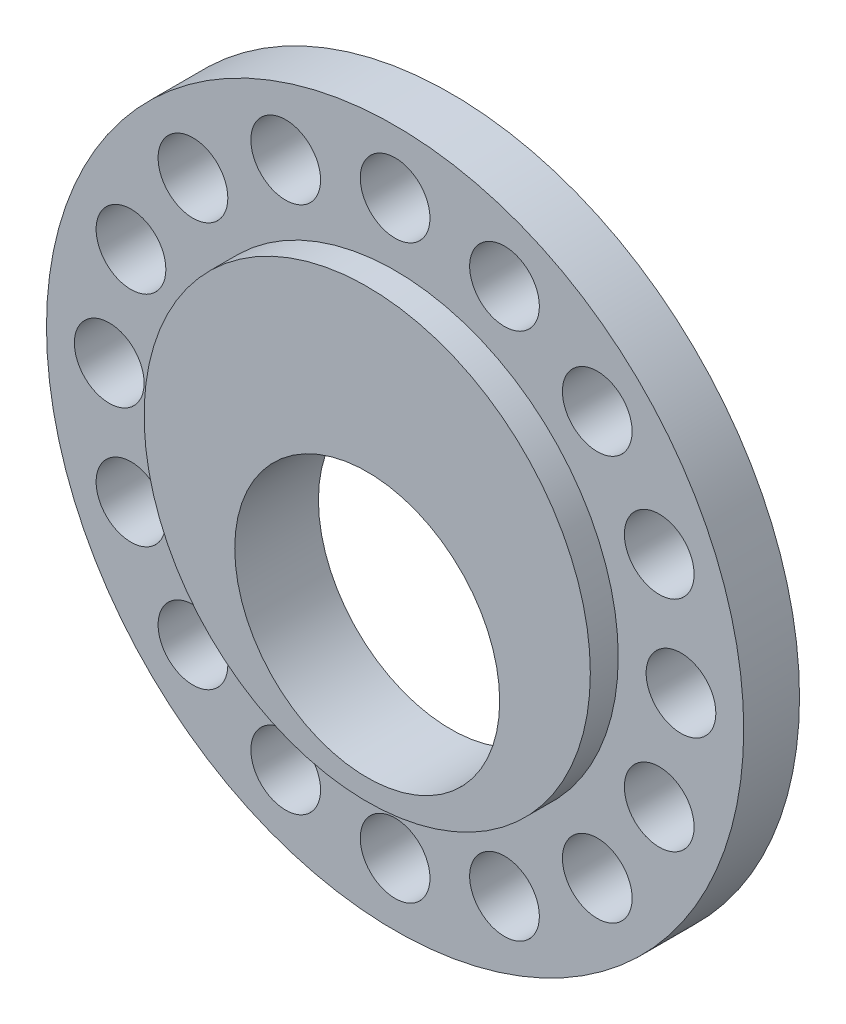
from build123d import *

# Parameters (mm, degrees)
SKETCH1_R           = 16
SKETCH1_R_2         = 9.5
BOSS_EXTRUDE1_DEPTH = 6
SKETCH1_3_R         = 25
SKETCH1_3_R_2       = 2.5
SKETCH1_3_R_3       = 16
BOSS_EXTRUDE2_DEPTH = 4


with BuildPart() as part:
    # Sketch1 → Boss-Extrude1 (new body)
    with BuildSketch(Plane(origin=(0, 0, 0), x_dir=(0, 1, 0), z_dir=(0, 0, 1))):
        Circle(SKETCH1_R)
        with Locations((-5, 0)):
            Circle(SKETCH1_R_2, mode=Mode.SUBTRACT)
    extrude(amount=BOSS_EXTRUDE1_DEPTH)

    # Sketch1<3> → Boss-Extrude2 (add)
    with BuildSketch(Plane(origin=(0, 0, 0), x_dir=(0, 1, 0), z_dir=(0, 0, 1))):
        Circle(SKETCH1_3_R)
        with Locations((-14.495689014, -14.495689014)):
            Circle(SKETCH1_3_R_2, mode=Mode.SUBTRACT)
        with Locations((-7.845010363, -18.939530416)):
            Circle(SKETCH1_3_R_2, mode=Mode.SUBTRACT)
        with Locations((0, -20.5)):
            Circle(SKETCH1_3_R_2, mode=Mode.SUBTRACT)
        with Locations((-18.939530416, -7.845010363)):
            Circle(SKETCH1_3_R_2, mode=Mode.SUBTRACT)
        with Locations((-20.5, 0)):
            Circle(SKETCH1_3_R_2, mode=Mode.SUBTRACT)
        with Locations((7.845010363, -18.939530416)):
            Circle(SKETCH1_3_R_2, mode=Mode.SUBTRACT)
        with Locations((14.495689014, -14.495689014)):
            Circle(SKETCH1_3_R_2, mode=Mode.SUBTRACT)
        with Locations((18.939530416, -7.845010363)):
            Circle(SKETCH1_3_R_2, mode=Mode.SUBTRACT)
        with Locations((20.5, 0)):
            Circle(SKETCH1_3_R_2, mode=Mode.SUBTRACT)
        with Locations((-18.939530416, 7.845010363)):
            Circle(SKETCH1_3_R_2, mode=Mode.SUBTRACT)
        with Locations((-14.495689014, 14.495689014)):
            Circle(SKETCH1_3_R_2, mode=Mode.SUBTRACT)
        with Locations((-7.845010363, 18.939530416)):
            Circle(SKETCH1_3_R_2, mode=Mode.SUBTRACT)
        Circle(SKETCH1_3_R_3, mode=Mode.SUBTRACT)
        with Locations((18.939530416, 7.845010363)):
            Circle(SKETCH1_3_R_2, mode=Mode.SUBTRACT)
        with Locations((0, 20.5)):
            Circle(SKETCH1_3_R_2, mode=Mode.SUBTRACT)
        with Locations((7.845010363, 18.939530416)):
            Circle(SKETCH1_3_R_2, mode=Mode.SUBTRACT)
        with Locations((14.495689014, 14.495689014)):
            Circle(SKETCH1_3_R_2, mode=Mode.SUBTRACT)
    extrude(amount=BOSS_EXTRUDE2_DEPTH)


solid = part.part
